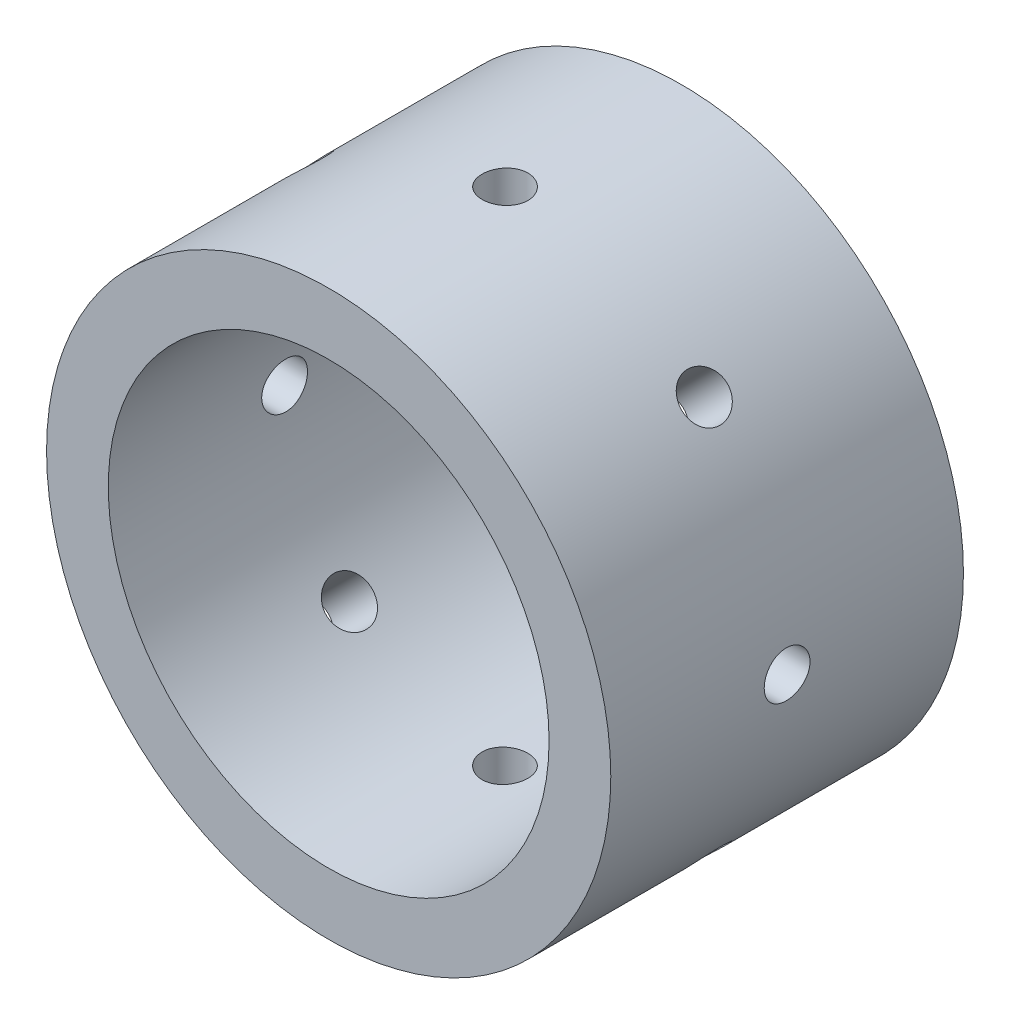
from build123d import *

# Parameters (mm, degrees)
SKETCH1_R           = 20.32
SKETCH1_R_2         = 15.875
BOSS_EXTRUDE1_DEPTH = 12.7
SKETCH3_W           = 1.65
SKETCH3_H           = 28.736819587
CIRPATTERN1_COUNT   = 8


with BuildPart() as part:
    # Sketch1 → Boss-Extrude1 (new, symmetric)
    with BuildSketch(Plane.XY):
        Circle(SKETCH1_R)
        Circle(SKETCH1_R_2, mode=Mode.SUBTRACT)
    extrude(amount=BOSS_EXTRUDE1_DEPTH, both=True)

    # Sketch3 → M4x0.7 Tapped Hole1 (revolve, cut)
    with BuildSketch(Plane(origin=(0, 0, 0), x_dir=(0, 0, -1), z_dir=(1, 0, 0))):
        with Locations((0.825, 14.368409794)):
            Rectangle(SKETCH3_W, SKETCH3_H)
    m4x0_7_tapped_hole1 = revolve(axis=Axis((0, -6.35, 0), (0, 1, 0)), mode=Mode.SUBTRACT)

    # CirPattern1: M4x0.7 Tapped Hole1 ×8 about axis
    cirpattern1_axis = Axis((0, 0, 12.7), (0, 0, -1))
    for i in range(1, CIRPATTERN1_COUNT):
        add(m4x0_7_tapped_hole1.rotate(cirpattern1_axis, i * 360 / CIRPATTERN1_COUNT), mode=Mode.SUBTRACT)


solid = part.part
